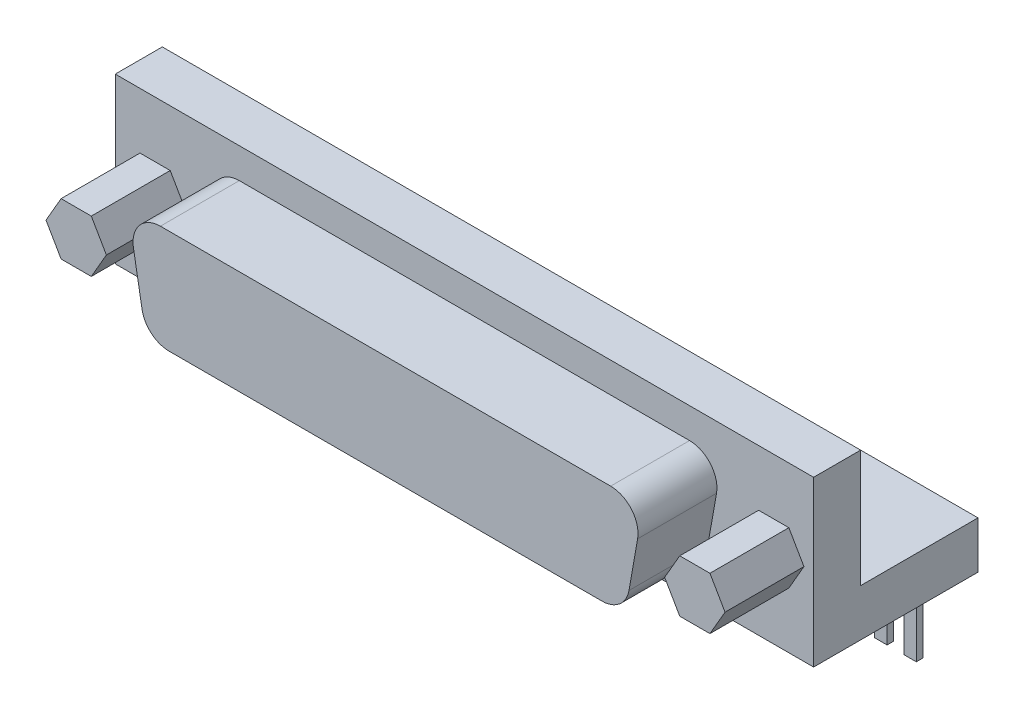
from build123d import *

# Parameters (mm, degrees)
BOSS_EXTRUDE1_DEPTH = 53.1
BOSS_EXTRUDE2_DEPTH = 6
SKETCH3_W           = 0.955506131
SKETCH3_H           = 0.5
BOSS_EXTRUDE3_DEPTH = 5
BOSS_EXTRUDE4_DEPTH = 6


with BuildPart() as part:
    # Sketch1 → Boss-Extrude1 (new body)
    with BuildSketch(Plane(origin=(0, 0, 0), x_dir=(0, 0, -1), z_dir=(1, 0, 0))):
        Polygon((0, 0), (12.5, 0), (12.5, 3.577441077), (3.577441077, 3.577441077), (3.577441077, 12.5), (0, 12.5), align=None)
    extrude(amount=BOSS_EXTRUDE1_DEPTH)

    # Sketch2 → Boss-Extrude2 (add)
    with BuildSketch(Plane.XY):
        with BuildLine():
            Line((9.4328, 10.2), (43.6672, 10.2))
            ThreePointArc((43.6672, 10.2), (45.262717366, 9.455998033), (45.718357588, 7.755525576))
            Line((45.718357588, 7.755525576), (45.059882111, 4.021125576))
            ThreePointArc((45.059882111, 4.021125576), (44.347522557, 2.787282634), (43.008724523, 2.3))
            Line((43.008724523, 2.3), (10.091275477, 2.3))
            ThreePointArc((10.091275477, 2.3), (8.752477443, 2.787282634), (8.040117889, 4.021125576))
            Line((8.040117889, 4.021125576), (7.381642412, 7.755525576))
            ThreePointArc((7.381642412, 7.755525576), (7.837282634, 9.455998033), (9.4328, 10.2))
        make_face()
    extrude(amount=BOSS_EXTRUDE2_DEPTH)

    # Sketch3 → Boss-Extrude3 (add)
    with BuildSketch(Plane.XZ):
        with Locations((1.917753066, -9.5)):
            Rectangle(SKETCH3_W, SKETCH3_H)
        with Locations((4.142246935, -9.5)):
            Rectangle(SKETCH3_W, SKETCH3_H)
        with Locations((48.957753066, -9.5)):
            Rectangle(SKETCH3_W, SKETCH3_H)
        with Locations((51.182246935, -9.5)):
            Rectangle(SKETCH3_W, SKETCH3_H)
    extrude(amount=BOSS_EXTRUDE3_DEPTH)

    # Sketch4 → Boss-Extrude4 (add)
    with BuildSketch(Plane.XY):
        Polygon((4.177995884, 4.261612802), (5.325991768, 6.25), (4.177995884, 8.238387198), (1.882004116, 8.238387198), (0.734008232, 6.25), (1.882004116, 4.261612802), align=None)
        Polygon((51.217995884, 4.261612802), (52.365991768, 6.25), (51.217995884, 8.238387198), (48.922004116, 8.238387198), (47.774008232, 6.25), (48.922004116, 4.261612802), align=None)
    extrude(amount=BOSS_EXTRUDE4_DEPTH)


solid = part.part
